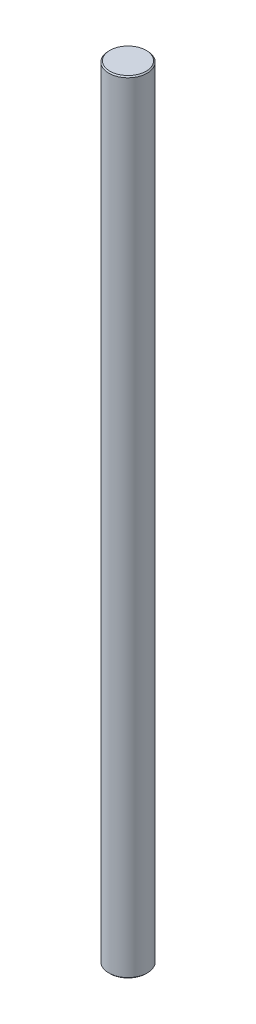
from build123d import *

# Parameters (mm, degrees)
SKETCH1_W     = 5
SKETCH1_H     = 203
CHAMFER1_SIZE = 0.3


with BuildPart() as part:
    # Sketch1 → Revolve1 (revolve)
    with BuildSketch(Plane.XY, mode=Mode.PRIVATE) as revolve1_sk:
        with Locations((2.5, 0)):
            Rectangle(SKETCH1_W, SKETCH1_H)
    revolve(revolve1_sk.sketch.rotate(Axis((0, 101.5, 0), (0, -1, 0)), 90), axis=Axis((0, 101.5, 0), (0, -1, 0)))

    # Chamfer1
    chamfer1_edges = [part.edges().sort_by_distance(p)[0] for p in [
        (0, 101.5, -5),
        (0, -101.5, -5),
    ]]
    chamfer(chamfer1_edges, length=CHAMFER1_SIZE)


solid = part.part
